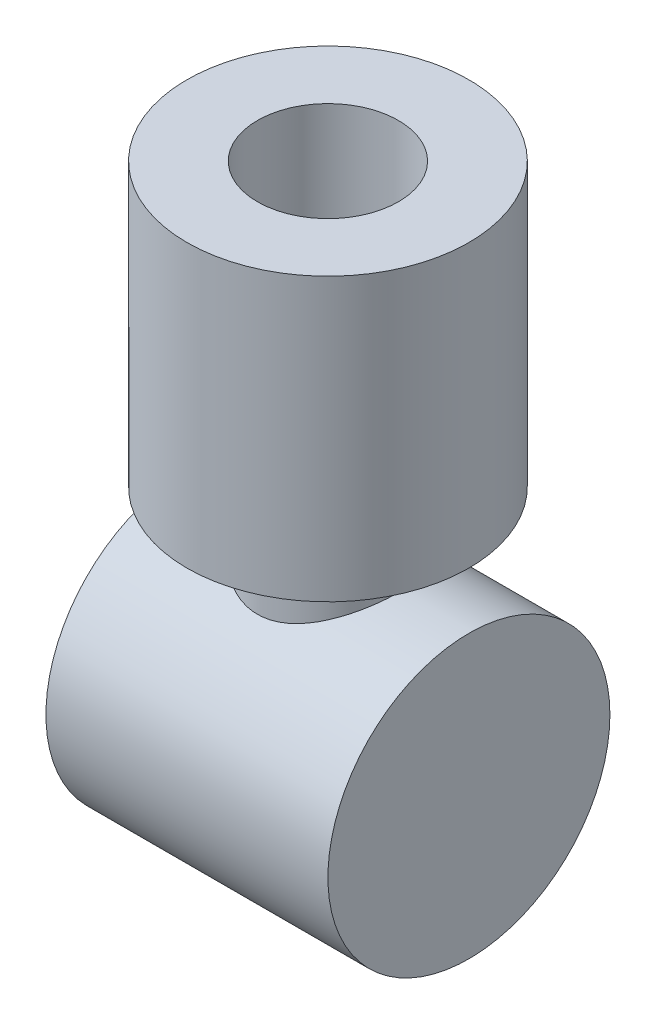
from build123d import *

# Parameters (mm, degrees)
CROQUIS1_R              = 50
SALIENTE_EXTRUIR1_DEPTH = 50
CROQUIS2_R              = 25
SALIENTE_EXTRUIR2_DEPTH = 70
CROQUIS4_R              = 50
SALIENTE_EXTRUIR3_DEPTH = 100
CORTAR_EXTRUIR1_START   = -50
CROQUIS5_R              = 25
CORTAR_EXTRUIR1_DEPTH   = 50


with BuildPart() as part:
    # Croquis1 → Saliente-Extruir1 (new, symmetric)
    with BuildSketch(Plane(origin=(0, 0, 0), x_dir=(0, 0, -1), z_dir=(1, 0, 0))):
        Circle(CROQUIS1_R)
    extrude(amount=SALIENTE_EXTRUIR1_DEPTH, both=True)

    # Croquis2 → Saliente-Extruir2 (add)
    with BuildSketch(Plane(origin=(0, 0, 0), x_dir=(1, 0, 0), z_dir=(0, 1, 0))):
        with Locations(Location((0, 0, 0), (0, 0, 90))):
            Circle(CROQUIS2_R)
    extrude(amount=SALIENTE_EXTRUIR2_DEPTH)

    # Croquis4 → Saliente-Extruir3 (add)
    with BuildSketch(Plane(origin=(0, 70, 0), x_dir=(1, 0, 0), z_dir=(0, 1, 0))):
        with Locations(Location((0, 0, 0), (0, 0, 270))):
            Circle(CROQUIS4_R)
    extrude(amount=SALIENTE_EXTRUIR3_DEPTH)

    # Croquis5 → Cortar-Extruir1 (cut)
    with BuildSketch(Plane(origin=(0, 170, 0), x_dir=(1, 0, 0), z_dir=(0, 1, 0)).offset(CORTAR_EXTRUIR1_START)):
        with Locations(Location((0, 0, 0), (0, 0, 90))):
            Circle(CROQUIS5_R)
    extrude(amount=CORTAR_EXTRUIR1_DEPTH, mode=Mode.SUBTRACT)


solid = part.part
